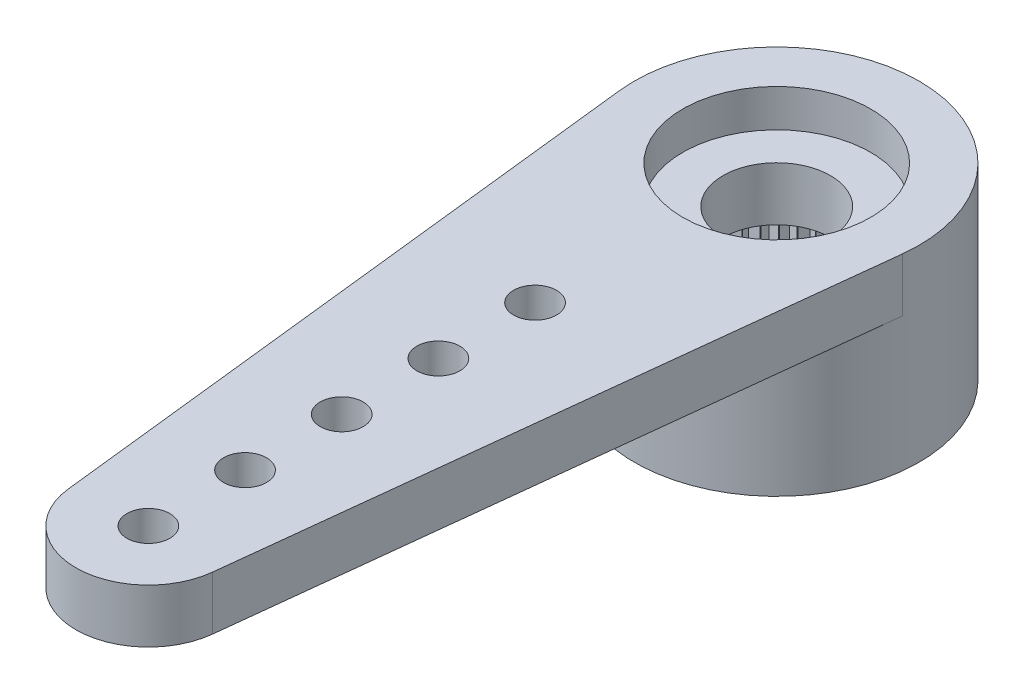
from build123d import *

# Parameters (mm, degrees)
BOSS_EXTRUDE1_DEPTH = 1.27
BOSS_EXTRUDE2_START = 3.175
SKETCH2_R           = 3.3655
BOSS_EXTRUDE2_DEPTH = 3.175
CUT_EXTRUDE1_DEPTH  = 2.286
CUT_EXTRUDE2_START  = -0.889
SKETCH4_R           = 2.2225
CUT_EXTRUDE2_DEPTH  = 0.889
CUT_EXTRUDE3_REACH  = 19.282
SKETCH5_R           = 1.27
CUT_EXTRUDE4_REACH  = 19.486
SKETCH6_R           = 0.508


with BuildPart() as part:
    # Sketch1 → Boss-Extrude1 (new body)
    with BuildSketch(Plane(origin=(0, 0, 0), x_dir=(1, 0, 0), z_dir=(0, 1, 0))):
        with BuildLine():
            Line((-1.703883799, -15.0495), (-3.34466079, -0.373944444))
            ThreePointArc((-3.34466079, -0.373944444), (0, 3.3655), (3.34466079, -0.373944444))
            Line((3.34466079, -0.373944444), (1.703883799, -15.0495))
            ThreePointArc((1.703883799, -15.0495), (0, -16.5735), (-1.703883799, -15.0495))
        make_face()
    extrude(amount=BOSS_EXTRUDE1_DEPTH)

    # Sketch2 → Boss-Extrude2 (add)
    with BuildSketch(Plane.XZ.offset(BOSS_EXTRUDE2_START)):
        with Locations(Location((0, 0, 0), (0, 0, 270))):
            Circle(SKETCH2_R)
    extrude(amount=-BOSS_EXTRUDE2_DEPTH)

    # Sketch3 → Cut-Extrude1 (cut)
    with BuildSketch(Plane(origin=(0, -3.175, 0), x_dir=(-1, 0, 0), z_dir=(0, -1, 0))):
        with BuildLine():
            Line((0.344662185, 2.452398872), (0.160511142, 2.216696286))
            ThreePointArc((0.160511142, 2.216696286), (0.155033763, 2.217086102), (0.149555438, 2.217462383))
            Line((0.149555438, 2.217462383), (0, 2.4765))
            Line((0, 2.4765), (-0.149555438, 2.217462383))
            ThreePointArc((-0.149555438, 2.217462383), (-0.155033763, 2.217086102), (-0.160511142, 2.216696286))
            Line((-0.160511142, 2.216696286), (-0.344662185, 2.452398872))
            Line((-0.344662185, 2.452398872), (-0.456711091, 2.175068098))
            ThreePointArc((-0.456711091, 2.175068098), (-0.462083733, 2.173933043), (-0.467453554, 2.172784717))
            Line((-0.467453554, 2.172784717), (-0.682615912, 2.38056459))
            Line((-0.682615912, 2.38056459), (-0.754977382, 2.090338586))
            ThreePointArc((-0.754977382, 2.090338586), (-0.760139769, 2.08846685), (-0.765297515, 2.086582364))
            Line((-0.765297515, 2.086582364), (-1.007283297, 2.262395326))
            Line((-1.007283297, 2.262395326), (-1.038548897, 1.964923011))
            ThreePointArc((-1.038548897, 1.964923011), (-1.043400548, 1.962351025), (-1.04824583, 1.95976706))
            Line((-1.04824583, 1.95976706), (-1.312345058, 2.10019111))
            Line((-1.312345058, 2.10019111), (-1.301906239, 1.801262445))
            ThreePointArc((-1.301906239, 1.801262445), (-1.306352723, 1.79804027), (-1.310791233, 1.794807119))
            Line((-1.310791233, 1.794807119), (-1.591863515, 1.897109063))
            Line((-1.591863515, 1.897109063), (-1.539923457, 1.602542354))
            ThreePointArc((-1.539923457, 1.602542354), (-1.543878228, 1.598732706), (-1.547823575, 1.594913299))
            Line((-1.547823575, 1.594913299), (-1.84039816, 1.657101947))
            Line((-1.84039816, 1.657101947), (-1.747967817, 1.372630599))
            ThreePointArc((-1.747967817, 1.372630599), (-1.7513539, 1.368307629), (-1.754729292, 1.363976306))
            Line((-1.754729292, 1.363976306), (-2.053111548, 1.384841225))
            Line((-2.053111548, 1.384841225), (-1.921989971, 1.116002151))
            ThreePointArc((-1.921989971, 1.116002151), (-1.92474146, 1.11125), (-1.927481199, 1.106491065))
            Line((-1.927481199, 1.106491065), (-2.225863456, 1.085626145))
            Line((-2.225863456, 1.085626145), (-2.058602777, 0.837651991))
            ThreePointArc((-2.058602777, 0.837651991), (-2.060666117, 0.832563154), (-2.062716877, 0.827469234))
            Line((-2.062716877, 0.827469234), (-2.355291463, 0.765280587))
            Line((-2.355291463, 0.765280587), (-2.155147221, 0.542997887))
            ThreePointArc((-2.155147221, 0.542997887), (-2.156482252, 0.537671413), (-2.157804118, 0.532341657))
            Line((-2.157804118, 0.532341657), (-2.4388764, 0.430039712))
            Line((-2.4388764, 0.430039712), (-2.209744176, 0.237774947))
            ThreePointArc((-2.209744176, 0.237774947), (-2.210324912, 0.23231451), (-2.210892156, 0.226852654))
            Line((-2.210892156, 0.226852654), (-2.474991383, 0.086428604))
            Line((-2.474991383, 0.086428604), (-2.221330975, -0.072076012))
            ThreePointArc((-2.221330975, -0.072076012), (-2.221146113, -0.077564131), (-2.220947692, -0.083051778))
            Line((-2.220947692, -0.083051778), (-2.462933474, -0.258864739))
            Line((-2.462933474, -0.258864739), (-2.189682092, -0.380524093))
            ThreePointArc((-2.189682092, -0.380524093), (-2.188735231, -0.385933075), (-2.187775009, -0.391339701))
            Line((-2.187775009, -0.391339701), (-2.402937366, -0.599119574))
            Line((-2.402937366, -0.599119574), (-2.115413539, -0.681565705))
            ThreePointArc((-2.115413539, -0.681565705), (-2.113723107, -0.68679027), (-2.112019773, -0.692010642))
            Line((-2.112019773, -0.692010642), (-2.296170816, -0.927713229))
            Line((-2.296170816, -0.927713229), (-1.999970867, -0.969341417))
            ThreePointArc((-1.999970867, -0.969341417), (-1.997569768, -0.974279874), (-1.995156475, -0.979212383))
            Line((-1.995156475, -0.979212383), (-2.144711912, -1.23825))
            Line((-2.144711912, -1.23825), (-1.845601037, -1.23825))
            ThreePointArc((-1.845601037, -1.23825), (-1.842536005, -1.242806228), (-1.839459725, -1.247354869))
            Line((-1.839459725, -1.247354869), (-1.951508631, -1.524685644))
            Line((-1.951508631, -1.524685644), (-1.655308682, -1.483057456))
            ThreePointArc((-1.655308682, -1.483057456), (-1.651639375, -1.487142773), (-1.647959984, -1.491219011))
            Line((-1.647959984, -1.491219011), (-1.720321454, -1.781445016))
            Line((-1.720321454, -1.781445016), (-1.432797627, -1.698998885))
            ThreePointArc((-1.432797627, -1.698998885), (-1.428595463, -1.702533775), (-1.424384577, -1.706058272))
            Line((-1.424384577, -1.706058272), (-1.455650177, -2.003530587))
            Line((-1.455650177, -2.003530587), (-1.182398796, -1.881871233))
            ThreePointArc((-1.182398796, -1.881871233), (-1.177745565, -1.884786894), (-1.173085144, -1.887691048))
            Line((-1.173085144, -1.887691048), (-1.162646325, -2.186619714))
            Line((-1.162646325, -2.186619714), (-0.908985917, -2.028115099))
            ThreePointArc((-0.908985917, -2.028115099), (-0.903972189, -2.03035478), (-0.898952943, -2.032582066))
            Line((-0.898952943, -2.032582066), (-0.847012885, -2.327148775))
            Line((-0.847012885, -2.327148775), (-0.617880661, -2.134884011))
            ThreePointArc((-0.617880661, -2.134884011), (-0.612604023, -2.136404119), (-0.607323646, -2.137911186))
            Line((-0.607323646, -2.137911186), (-0.514893302, -2.422382533))
            Line((-0.514893302, -2.422382533), (-0.314749061, -2.200099834))
            ThreePointArc((-0.314749061, -2.200099834), (-0.309312217, -2.200870783), (-0.303873485, -2.201628296))
            Line((-0.303873485, -2.201628296), (-0.172751907, -2.47046737))
            Line((-0.172751907, -2.47046737), (-0.005491228, -2.222493216))
            ThreePointArc((-0.005491228, -2.222493216), (0, -2.2225), (0.005491228, -2.222493216))
            Line((0.005491228, -2.222493216), (0.172751907, -2.47046737))
            Line((0.172751907, -2.47046737), (0.303873485, -2.201628296))
            ThreePointArc((0.303873485, -2.201628296), (0.309312217, -2.200870783), (0.314749061, -2.200099834))
            Line((0.314749061, -2.200099834), (0.514893302, -2.422382533))
            Line((0.514893302, -2.422382533), (0.607323646, -2.137911186))
            ThreePointArc((0.607323646, -2.137911186), (0.612604023, -2.136404119), (0.617880661, -2.134884011))
            Line((0.617880661, -2.134884011), (0.847012885, -2.327148775))
            Line((0.847012885, -2.327148775), (0.898952943, -2.032582066))
            ThreePointArc((0.898952943, -2.032582066), (0.903972189, -2.03035478), (0.908985917, -2.028115099))
            Line((0.908985917, -2.028115099), (1.162646325, -2.186619714))
            Line((1.162646325, -2.186619714), (1.173085144, -1.887691048))
            ThreePointArc((1.173085144, -1.887691048), (1.177745565, -1.884786894), (1.182398796, -1.881871233))
            Line((1.182398796, -1.881871233), (1.455650177, -2.003530587))
            Line((1.455650177, -2.003530587), (1.424384577, -1.706058272))
            ThreePointArc((1.424384577, -1.706058272), (1.428595463, -1.702533775), (1.432797627, -1.698998885))
            Line((1.432797627, -1.698998885), (1.720321454, -1.781445016))
            Line((1.720321454, -1.781445016), (1.647959984, -1.491219011))
            ThreePointArc((1.647959984, -1.491219011), (1.651639375, -1.487142773), (1.655308682, -1.483057456))
            Line((1.655308682, -1.483057456), (1.951508631, -1.524685644))
            Line((1.951508631, -1.524685644), (1.839459725, -1.247354869))
            ThreePointArc((1.839459725, -1.247354869), (1.842536005, -1.242806228), (1.845601037, -1.23825))
            Line((1.845601037, -1.23825), (2.144711912, -1.23825))
            Line((2.144711912, -1.23825), (1.995156475, -0.979212383))
            ThreePointArc((1.995156475, -0.979212383), (1.997569768, -0.974279874), (1.999970867, -0.969341417))
            Line((1.999970867, -0.969341417), (2.296170816, -0.927713229))
            Line((2.296170816, -0.927713229), (2.112019773, -0.692010642))
            ThreePointArc((2.112019773, -0.692010642), (2.113723107, -0.68679027), (2.115413539, -0.681565705))
            Line((2.115413539, -0.681565705), (2.402937366, -0.599119574))
            Line((2.402937366, -0.599119574), (2.187775009, -0.391339701))
            ThreePointArc((2.187775009, -0.391339701), (2.188735231, -0.385933075), (2.189682092, -0.380524093))
            Line((2.189682092, -0.380524093), (2.462933474, -0.258864739))
            Line((2.462933474, -0.258864739), (2.220947692, -0.083051778))
            ThreePointArc((2.220947692, -0.083051778), (2.221146113, -0.077564131), (2.221330975, -0.072076012))
            Line((2.221330975, -0.072076012), (2.474991383, 0.086428604))
            Line((2.474991383, 0.086428604), (2.210892156, 0.226852654))
            ThreePointArc((2.210892156, 0.226852654), (2.210324912, 0.23231451), (2.209744176, 0.237774947))
            Line((2.209744176, 0.237774947), (2.4388764, 0.430039712))
            Line((2.4388764, 0.430039712), (2.157804118, 0.532341657))
            ThreePointArc((2.157804118, 0.532341657), (2.156482252, 0.537671413), (2.155147221, 0.542997887))
            Line((2.155147221, 0.542997887), (2.355291463, 0.765280587))
            Line((2.355291463, 0.765280587), (2.062716877, 0.827469234))
            ThreePointArc((2.062716877, 0.827469234), (2.060666117, 0.832563154), (2.058602777, 0.837651991))
            Line((2.058602777, 0.837651991), (2.225863456, 1.085626145))
            Line((2.225863456, 1.085626145), (1.927481199, 1.106491065))
            ThreePointArc((1.927481199, 1.106491065), (1.92474146, 1.11125), (1.921989971, 1.116002151))
            Line((1.921989971, 1.116002151), (2.053111548, 1.384841225))
            Line((2.053111548, 1.384841225), (1.754729292, 1.363976306))
            ThreePointArc((1.754729292, 1.363976306), (1.7513539, 1.368307629), (1.747967817, 1.372630599))
            Line((1.747967817, 1.372630599), (1.84039816, 1.657101947))
            Line((1.84039816, 1.657101947), (1.547823575, 1.594913299))
            ThreePointArc((1.547823575, 1.594913299), (1.543878228, 1.598732706), (1.539923457, 1.602542354))
            Line((1.539923457, 1.602542354), (1.591863515, 1.897109063))
            Line((1.591863515, 1.897109063), (1.310791233, 1.794807119))
            ThreePointArc((1.310791233, 1.794807119), (1.306352723, 1.79804027), (1.301906239, 1.801262445))
            Line((1.301906239, 1.801262445), (1.312345058, 2.10019111))
            Line((1.312345058, 2.10019111), (1.04824583, 1.95976706))
            ThreePointArc((1.04824583, 1.95976706), (1.043400548, 1.962351025), (1.038548897, 1.964923011))
            Line((1.038548897, 1.964923011), (1.007283297, 2.262395326))
            Line((1.007283297, 2.262395326), (0.765297515, 2.086582364))
            ThreePointArc((0.765297515, 2.086582364), (0.760139769, 2.08846685), (0.754977382, 2.090338586))
            Line((0.754977382, 2.090338586), (0.682615912, 2.38056459))
            Line((0.682615912, 2.38056459), (0.467453554, 2.172784717))
            ThreePointArc((0.467453554, 2.172784717), (0.462083733, 2.173933043), (0.456711091, 2.175068098))
            Line((0.456711091, 2.175068098), (0.344662185, 2.452398872))
        make_face()
    extrude(amount=-CUT_EXTRUDE1_DEPTH, mode=Mode.SUBTRACT)

    # Sketch4 → Cut-Extrude2 (cut)
    with BuildSketch(Plane(origin=(0, 1.27, 0), x_dir=(1, 0, 0), z_dir=(0, 1, 0)).offset(CUT_EXTRUDE2_START)):
        with Locations(Location((0, 0, 0), (0, 0, 270))):
            Circle(SKETCH4_R)
    extrude(amount=CUT_EXTRUDE2_DEPTH, mode=Mode.SUBTRACT)

    # Sketch5 → Cut-Extrude3 (cut, up to next)
    with BuildSketch(Plane(origin=(0, 0.381, 0), x_dir=(1, 0, 0), z_dir=(0, 1, 0)), mode=Mode.PRIVATE) as cut_extrude3_sk1:
        with Locations(Location((0, 0, 0), (0, 0, 270))):
            Circle(SKETCH5_R)
    cut_extrude3_tool1 = extrude(cut_extrude3_sk1.sketch, amount=-CUT_EXTRUDE3_REACH, mode=Mode.PRIVATE) & part.part
    add(cut_extrude3_tool1.solids().sort_by_distance((0, 0.381, 0))[0], mode=Mode.SUBTRACT)

    # Sketch6 → Cut-Extrude4 (cut, up to next)
    with BuildSketch(Plane(origin=(0, 1.27, 0), x_dir=(1, 0, 0), z_dir=(0, 1, 0)), mode=Mode.PRIVATE) as cut_extrude4_sk1:
        with Locations(Location((0, -14.859, 0), (0, 0, 270))):
            Circle(SKETCH6_R)
    cut_extrude4_tool1 = extrude(cut_extrude4_sk1.sketch, amount=-CUT_EXTRUDE4_REACH, mode=Mode.PRIVATE) & part.part
    # Sketch6 → Cut-Extrude4 (cut, up to next)
    with BuildSketch(Plane(origin=(0, 1.27, 0), x_dir=(1, 0, 0), z_dir=(0, 1, 0)), mode=Mode.PRIVATE) as cut_extrude4_sk2:
        with Locations(Location((0, -12.573, 0), (0, 0, 270))):
            Circle(SKETCH6_R)
    cut_extrude4_tool2 = extrude(cut_extrude4_sk2.sketch, amount=-CUT_EXTRUDE4_REACH, mode=Mode.PRIVATE) & part.part
    # Sketch6 → Cut-Extrude4 (cut, up to next)
    with BuildSketch(Plane(origin=(0, 1.27, 0), x_dir=(1, 0, 0), z_dir=(0, 1, 0)), mode=Mode.PRIVATE) as cut_extrude4_sk3:
        with Locations(Location((0, -10.287, 0), (0, 0, 270))):
            Circle(SKETCH6_R)
    cut_extrude4_tool3 = extrude(cut_extrude4_sk3.sketch, amount=-CUT_EXTRUDE4_REACH, mode=Mode.PRIVATE) & part.part
    # Sketch6 → Cut-Extrude4 (cut, up to next)
    with BuildSketch(Plane(origin=(0, 1.27, 0), x_dir=(1, 0, 0), z_dir=(0, 1, 0)), mode=Mode.PRIVATE) as cut_extrude4_sk4:
        with Locations(Location((0, -8.001, 0), (0, 0, 270))):
            Circle(SKETCH6_R)
    cut_extrude4_tool4 = extrude(cut_extrude4_sk4.sketch, amount=-CUT_EXTRUDE4_REACH, mode=Mode.PRIVATE) & part.part
    # Sketch6 → Cut-Extrude4 (cut, up to next)
    with BuildSketch(Plane(origin=(0, 1.27, 0), x_dir=(1, 0, 0), z_dir=(0, 1, 0)), mode=Mode.PRIVATE) as cut_extrude4_sk5:
        with Locations(Location((0, -5.715, 0), (0, 0, 270))):
            Circle(SKETCH6_R)
    cut_extrude4_tool5 = extrude(cut_extrude4_sk5.sketch, amount=-CUT_EXTRUDE4_REACH, mode=Mode.PRIVATE) & part.part
    add(cut_extrude4_tool1.solids().sort_by_distance((0, 1.27, 14.859))[0], mode=Mode.SUBTRACT)
    add(cut_extrude4_tool2.solids().sort_by_distance((0, 1.27, 12.573))[0], mode=Mode.SUBTRACT)
    add(cut_extrude4_tool3.solids().sort_by_distance((0, 1.27, 10.287))[0], mode=Mode.SUBTRACT)
    add(cut_extrude4_tool4.solids().sort_by_distance((0, 1.27, 8.001))[0], mode=Mode.SUBTRACT)
    add(cut_extrude4_tool5.solids().sort_by_distance((0, 1.27, 5.715))[0], mode=Mode.SUBTRACT)


solid = part.part
